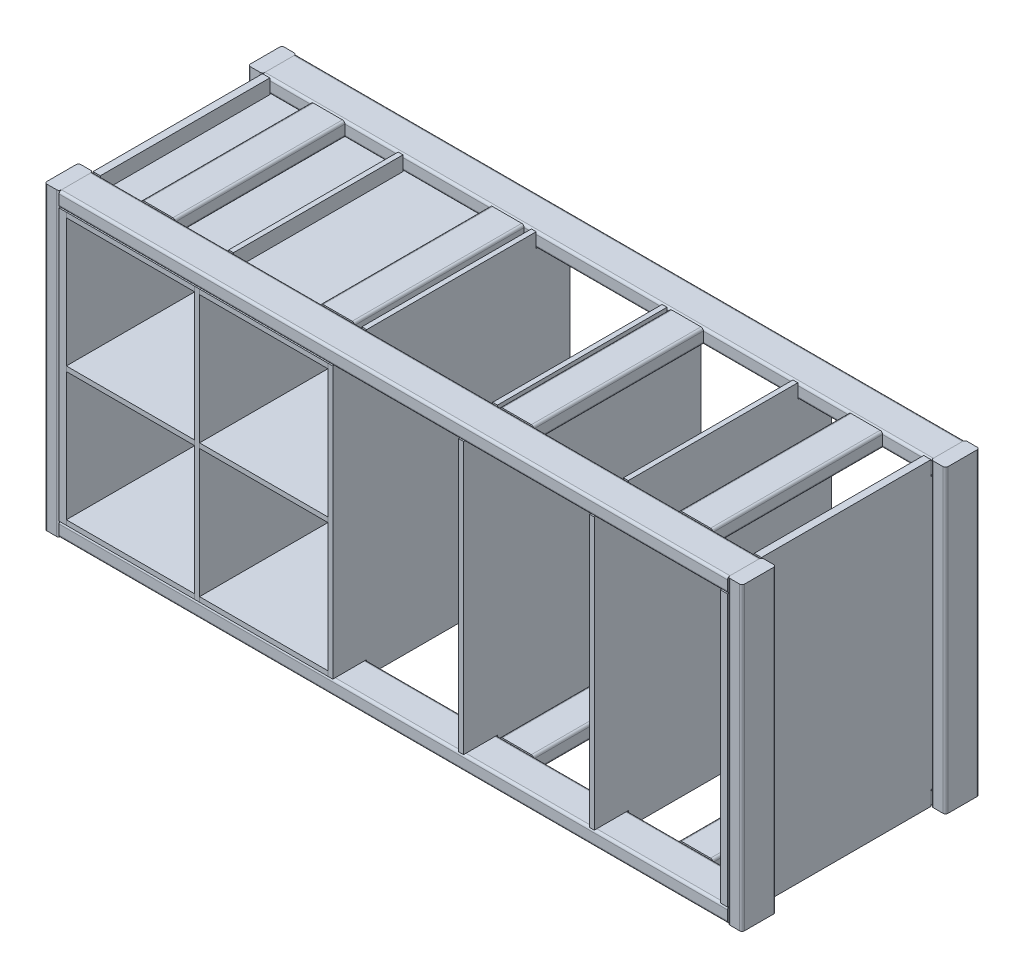
from build123d import *

# Parameters (mm, degrees)
BOSS_EXTRUDE1_DEPTH    = 787.4
BOSS_EXTRUDE1_2_DEPTH  = 787.4
BOSS_EXTRUDE1_3_DEPTH  = 787.4
BOSS_EXTRUDE1_4_DEPTH  = 787.4
BOSS_EXTRUDE2_DEPTH    = 1752.6
BOSS_EXTRUDE2_2_DEPTH  = 1752.6
BOSS_EXTRUDE2_3_DEPTH  = 1752.6
BOSS_EXTRUDE2_4_DEPTH  = 1752.6
BOSS_EXTRUDE5_DEPTH    = 19.05
BOSS_EXTRUDE7_DEPTH    = 12.7
LPATTERN1_COUNT        = 3
LPATTERN1_PITCH        = 342.9
BOSS_EXTRUDE3_DEPTH    = 444.5
BOSS_EXTRUDE3_2_DEPTH  = 444.5
BOSS_EXTRUDE3_3_DEPTH  = 444.5
BOSS_EXTRUDE3_4_DEPTH  = 444.5
BOSS_EXTRUDE6_DEPTH    = 444.5
BOSS_EXTRUDE6_2_DEPTH  = 444.5
BOSS_EXTRUDE6_3_DEPTH  = 444.5
BOSS_EXTRUDE6_4_DEPTH  = 444.5
BOSS_EXTRUDE8_DEPTH    = 6.35
SKETCH14_W             = 685.8
SKETCH14_H             = 711.2
BOSS_EXTRUDE9_DEPTH    = 12.7
SKETCH15_W             = 336.55
SKETCH15_H             = 609.6
BOSS_EXTRUDE10_DEPTH   = 12.7
BOSS_EXTRUDE10_2_DEPTH = 12.7
LPATTERN3_COUNT        = 3
LPATTERN3_PITCH        = 349.25


with BuildPart() as part:
    # Sketch2 → Boss-Extrude1 (new body)
    with BuildSketch(Plane(origin=(0, 0, 0), x_dir=(1, 0, 0), z_dir=(0, 1, 0))):
        with BuildLine():
            Line((12.7, 0), (38.1, 0))
            ThreePointArc((38.1, 0), (42.590128061, -1.859871939), (44.45, -6.35))
            Line((44.45, -6.35), (44.45, -82.55))
            ThreePointArc((44.45, -82.55), (42.590128061, -87.040128061), (38.1, -88.9))
            Line((38.1, -88.9), (12.7, -88.9))
            ThreePointArc((12.7, -88.9), (8.209871939, -87.040128061), (6.35, -82.55))
            Line((6.35, -82.55), (6.35, -6.35))
            ThreePointArc((6.35, -6.35), (8.209871939, -1.859871939), (12.7, 0))
        make_face()
    extrude(amount=BOSS_EXTRUDE1_DEPTH)


with BuildPart() as body_2:
    # Sketch2 → Boss-Extrude1 2 (new body)
    with BuildSketch(Plane(origin=(0, 0, 0), x_dir=(1, 0, 0), z_dir=(0, 1, 0))):
        with BuildLine():
            Line((12.7, -533.4), (38.1, -533.4))
            ThreePointArc((38.1, -533.4), (42.590128061, -535.259871939), (44.45, -539.75))
            Line((44.45, -539.75), (44.45, -615.95))
            ThreePointArc((44.45, -615.95), (42.590128061, -620.440128061), (38.1, -622.3))
            Line((38.1, -622.3), (12.7, -622.3))
            ThreePointArc((12.7, -622.3), (8.209871939, -620.440128061), (6.35, -615.95))
            Line((6.35, -615.95), (6.35, -539.75))
            ThreePointArc((6.35, -539.75), (8.209871939, -535.259871939), (12.7, -533.4))
        make_face()
    extrude(amount=BOSS_EXTRUDE1_2_DEPTH)


with BuildPart() as body_3:
    # Sketch2 → Boss-Extrude1 3 (new body)
    with BuildSketch(Plane(origin=(0, 0, 0), x_dir=(1, 0, 0), z_dir=(0, 1, 0))):
        with BuildLine():
            Line((1803.4, -622.3), (1828.8, -622.3))
            ThreePointArc((1828.8, -622.3), (1833.290128061, -620.440128061), (1835.15, -615.95))
            Line((1835.15, -615.95), (1835.15, -539.75))
            ThreePointArc((1835.15, -539.75), (1833.290128061, -535.259871939), (1828.8, -533.4))
            Line((1828.8, -533.4), (1803.4, -533.4))
            ThreePointArc((1803.4, -533.4), (1798.909871939, -535.259871939), (1797.05, -539.75))
            Line((1797.05, -539.75), (1797.05, -615.95))
            ThreePointArc((1797.05, -615.95), (1798.909871939, -620.440128061), (1803.4, -622.3))
        make_face()
    extrude(amount=BOSS_EXTRUDE1_3_DEPTH)


with BuildPart() as body_4:
    # Sketch2 → Boss-Extrude1 4 (new body)
    with BuildSketch(Plane(origin=(0, 0, 0), x_dir=(1, 0, 0), z_dir=(0, 1, 0))):
        with BuildLine():
            Line((1828.8, -88.9), (1803.4, -88.9))
            ThreePointArc((1803.4, -88.9), (1798.909871939, -87.040128061), (1797.05, -82.55))
            Line((1797.05, -82.55), (1797.05, -6.35))
            ThreePointArc((1797.05, -6.35), (1798.909871939, -1.859871939), (1803.4, 0))
            Line((1803.4, 0), (1828.8, 0))
            ThreePointArc((1828.8, 0), (1833.290128061, -1.859871939), (1835.15, -6.35))
            Line((1835.15, -6.35), (1835.15, -82.55))
            ThreePointArc((1835.15, -82.55), (1833.290128061, -87.040128061), (1828.8, -88.9))
        make_face()
    extrude(amount=BOSS_EXTRUDE1_4_DEPTH)


with BuildPart() as body_5:
    # Sketch3 → Boss-Extrude2 (new body)
    with BuildSketch(Plane(origin=(44.45, 0, 0), x_dir=(0, 0, -1), z_dir=(1, 0, 0))):
        with BuildLine():
            Line((-615.95, 0), (-539.75, 0))
            ThreePointArc((-539.75, 0), (-535.259871939, 1.859871939), (-533.4, 6.35))
            Line((-533.4, 6.35), (-533.4, 31.75))
            ThreePointArc((-533.4, 31.75), (-535.259871939, 36.240128061), (-539.75, 38.1))
            Line((-539.75, 38.1), (-615.95, 38.1))
            ThreePointArc((-615.95, 38.1), (-620.440128061, 36.240128061), (-622.3, 31.75))
            Line((-622.3, 31.75), (-622.3, 6.35))
            ThreePointArc((-622.3, 6.35), (-620.440128061, 1.859871939), (-615.95, 0))
        make_face()
    extrude(amount=BOSS_EXTRUDE2_DEPTH)


with BuildPart() as body_6:
    # Sketch3 → Boss-Extrude2 2 (new body)
    with BuildSketch(Plane(origin=(44.45, 0, 0), x_dir=(0, 0, -1), z_dir=(1, 0, 0))):
        with BuildLine():
            Line((-82.55, 0), (-6.35, 0))
            ThreePointArc((-6.35, 0), (-1.859871939, 1.859871939), (0, 6.35))
            Line((0, 6.35), (0, 31.75))
            ThreePointArc((0, 31.75), (-1.859871939, 36.240128061), (-6.35, 38.1))
            Line((-6.35, 38.1), (-82.55, 38.1))
            ThreePointArc((-82.55, 38.1), (-87.040128061, 36.240128061), (-88.9, 31.75))
            Line((-88.9, 31.75), (-88.9, 6.35))
            ThreePointArc((-88.9, 6.35), (-87.040128061, 1.859871939), (-82.55, 0))
        make_face()
    extrude(amount=BOSS_EXTRUDE2_2_DEPTH)


with BuildPart() as body_7:
    # Sketch3 → Boss-Extrude2 3 (new body)
    with BuildSketch(Plane(origin=(44.45, 0, 0), x_dir=(0, 0, -1), z_dir=(1, 0, 0))):
        with BuildLine():
            Line((-6.35, 787.4), (-82.55, 787.4))
            ThreePointArc((-82.55, 787.4), (-87.040128061, 785.540128061), (-88.9, 781.05))
            Line((-88.9, 781.05), (-88.9, 755.65))
            ThreePointArc((-88.9, 755.65), (-87.040128061, 751.159871939), (-82.55, 749.3))
            Line((-82.55, 749.3), (-6.35, 749.3))
            ThreePointArc((-6.35, 749.3), (-1.859871939, 751.159871939), (0, 755.65))
            Line((0, 755.65), (0, 781.05))
            ThreePointArc((0, 781.05), (-1.859871939, 785.540128061), (-6.35, 787.4))
        make_face()
    extrude(amount=BOSS_EXTRUDE2_3_DEPTH)


with BuildPart() as body_8:
    # Sketch3 → Boss-Extrude2 4 (new body)
    with BuildSketch(Plane(origin=(44.45, 0, 0), x_dir=(0, 0, -1), z_dir=(1, 0, 0))):
        with BuildLine():
            Line((-539.75, 749.3), (-615.95, 749.3))
            ThreePointArc((-615.95, 749.3), (-620.440128061, 751.159871939), (-622.3, 755.65))
            Line((-622.3, 755.65), (-622.3, 781.05))
            ThreePointArc((-622.3, 781.05), (-620.440128061, 785.540128061), (-615.95, 787.4))
            Line((-615.95, 787.4), (-539.75, 787.4))
            ThreePointArc((-539.75, 787.4), (-535.259871939, 785.540128061), (-533.4, 781.05))
            Line((-533.4, 781.05), (-533.4, 755.65))
            ThreePointArc((-533.4, 755.65), (-535.259871939, 751.159871939), (-539.75, 749.3))
        make_face()
    extrude(amount=BOSS_EXTRUDE2_4_DEPTH)


with BuildPart() as body_9:
    # Sketch8 → Boss-Extrude5 (new body)
    with BuildSketch(Plane.ZY.offset(-1797.05)):
        Polygon((622.3, 38.1), (622.3, 749.3), (533.4, 749.3), (533.4, 787.4), (88.9, 787.4), (88.9, 749.3), (0, 749.3), (0, 38.1), (88.9, 38.1), (88.9, 0), (533.4, 0), (533.4, 38.1), align=None)
    extrude(amount=BOSS_EXTRUDE5_DEPTH)


with BuildPart() as body_10:
    # Mirror1: mirrored copy
    add(body_9.part.mirror(Plane(origin=(920.75, 0, 0), x_dir=(0, 0, 1), z_dir=(1, 0, 0))))


with BuildPart() as body_11:
    # Sketch12 → Boss-Extrude7 (new body)
    with BuildSketch(Plane.ZY.offset(-1447.8)):
        Polygon((622.3, 38.1), (622.3, 749.3), (533.4, 749.3), (533.4, 787.4), (88.9, 787.4), (88.9, 749.3), (0, 749.3), (0, 38.1), (88.9, 38.1), (88.9, 0), (533.4, 0), (533.4, 38.1), align=None)
    extrude(amount=BOSS_EXTRUDE7_DEPTH)


with BuildPart() as lpattern1_1:
    # LPattern1: pattern copy
    add(body_11.part.moved(Location(Vector(-1, 0, 0) * (1 * LPATTERN1_PITCH))))


with BuildPart() as lpattern1_2:
    # LPattern1: pattern copy
    add(body_11.part.moved(Location(Vector(-1, 0, 0) * (2 * LPATTERN1_PITCH))))


with BuildPart() as body_14:
    # Sketch4 → Boss-Extrude3 (new body)
    with BuildSketch(Plane.XY.offset(88.9)):
        with BuildLine():
            Line((647.7, 38.1), (723.9, 38.1))
            ThreePointArc((723.9, 38.1), (728.390128061, 36.240128061), (730.25, 31.75))
            Line((730.25, 31.75), (730.25, 6.35))
            ThreePointArc((730.25, 6.35), (728.390128061, 1.859871939), (723.9, 0))
            Line((723.9, 0), (647.7, 0))
            ThreePointArc((647.7, 0), (643.209871939, 1.859871939), (641.35, 6.35))
            Line((641.35, 6.35), (641.35, 31.75))
            ThreePointArc((641.35, 31.75), (643.209871939, 36.240128061), (647.7, 38.1))
        make_face()
    extrude(amount=BOSS_EXTRUDE3_DEPTH)


with BuildPart() as body_15:
    # Sketch4 → Boss-Extrude3 2 (new body)
    with BuildSketch(Plane.XY.offset(88.9)):
        with BuildLine():
            Line((1117.6, 38.1), (1193.8, 38.1))
            ThreePointArc((1193.8, 38.1), (1198.290128061, 36.240128061), (1200.15, 31.75))
            Line((1200.15, 31.75), (1200.15, 6.35))
            ThreePointArc((1200.15, 6.35), (1198.290128061, 1.859871939), (1193.8, 0))
            Line((1193.8, 0), (1117.6, 0))
            ThreePointArc((1117.6, 0), (1113.109871939, 1.859871939), (1111.25, 6.35))
            Line((1111.25, 6.35), (1111.25, 31.75))
            ThreePointArc((1111.25, 31.75), (1113.109871939, 36.240128061), (1117.6, 38.1))
        make_face()
    extrude(amount=BOSS_EXTRUDE3_2_DEPTH)


with BuildPart() as body_16:
    # Sketch4 → Boss-Extrude3 3 (new body)
    with BuildSketch(Plane.XY.offset(88.9)):
        with BuildLine():
            Line((1193.8, 749.3), (1117.6, 749.3))
            ThreePointArc((1117.6, 749.3), (1113.109871939, 751.159871939), (1111.25, 755.65))
            Line((1111.25, 755.65), (1111.25, 781.05))
            ThreePointArc((1111.25, 781.05), (1113.109871939, 785.540128061), (1117.6, 787.4))
            Line((1117.6, 787.4), (1193.8, 787.4))
            ThreePointArc((1193.8, 787.4), (1198.290128061, 785.540128061), (1200.15, 781.05))
            Line((1200.15, 781.05), (1200.15, 755.65))
            ThreePointArc((1200.15, 755.65), (1198.290128061, 751.159871939), (1193.8, 749.3))
        make_face()
    extrude(amount=BOSS_EXTRUDE3_3_DEPTH)


with BuildPart() as body_17:
    # Sketch4 → Boss-Extrude3 4 (new body)
    with BuildSketch(Plane.XY.offset(88.9)):
        with BuildLine():
            Line((723.9, 787.4), (647.7, 787.4))
            ThreePointArc((647.7, 787.4), (643.209871939, 785.540128061), (641.35, 781.05))
            Line((641.35, 781.05), (641.35, 755.65))
            ThreePointArc((641.35, 755.65), (643.209871939, 751.159871939), (647.7, 749.3))
            Line((647.7, 749.3), (723.9, 749.3))
            ThreePointArc((723.9, 749.3), (728.390128061, 751.159871939), (730.25, 755.65))
            Line((730.25, 755.65), (730.25, 781.05))
            ThreePointArc((730.25, 781.05), (728.390128061, 785.540128061), (723.9, 787.4))
        make_face()
    extrude(amount=BOSS_EXTRUDE3_4_DEPTH)


with BuildPart() as body_18:
    # Sketch10 → Boss-Extrude6 (new body)
    with BuildSketch(Plane.XY.offset(88.9)):
        with BuildLine():
            Line((177.8, 38.1), (254, 38.1))
            ThreePointArc((254, 38.1), (258.490128061, 36.240128061), (260.35, 31.75))
            Line((260.35, 31.75), (260.35, 6.35))
            ThreePointArc((260.35, 6.35), (258.490128061, 1.859871939), (254, 0))
            Line((254, 0), (177.8, 0))
            ThreePointArc((177.8, 0), (173.309871939, 1.859871939), (171.45, 6.35))
            Line((171.45, 6.35), (171.45, 31.75))
            ThreePointArc((171.45, 31.75), (173.309871939, 36.240128061), (177.8, 38.1))
        make_face()
    extrude(amount=BOSS_EXTRUDE6_DEPTH)


with BuildPart() as body_19:
    # Sketch10 → Boss-Extrude6 2 (new body)
    with BuildSketch(Plane.XY.offset(88.9)):
        with BuildLine():
            Line((1587.5, 38.1), (1663.7, 38.1))
            ThreePointArc((1663.7, 38.1), (1668.190128061, 36.240128061), (1670.05, 31.75))
            Line((1670.05, 31.75), (1670.05, 6.35))
            ThreePointArc((1670.05, 6.35), (1668.190128061, 1.859871939), (1663.7, 0))
            Line((1663.7, 0), (1587.5, 0))
            ThreePointArc((1587.5, 0), (1583.009871939, 1.859871939), (1581.15, 6.35))
            Line((1581.15, 6.35), (1581.15, 31.75))
            ThreePointArc((1581.15, 31.75), (1583.009871939, 36.240128061), (1587.5, 38.1))
        make_face()
    extrude(amount=BOSS_EXTRUDE6_2_DEPTH)


with BuildPart() as body_20:
    # Sketch10 → Boss-Extrude6 3 (new body)
    with BuildSketch(Plane.XY.offset(88.9)):
        with BuildLine():
            Line((1663.7, 749.3), (1587.5, 749.3))
            ThreePointArc((1587.5, 749.3), (1583.009871939, 751.159871939), (1581.15, 755.65))
            Line((1581.15, 755.65), (1581.15, 781.05))
            ThreePointArc((1581.15, 781.05), (1583.009871939, 785.540128061), (1587.5, 787.4))
            Line((1587.5, 787.4), (1663.7, 787.4))
            ThreePointArc((1663.7, 787.4), (1668.190128061, 785.540128061), (1670.05, 781.05))
            Line((1670.05, 781.05), (1670.05, 755.65))
            ThreePointArc((1670.05, 755.65), (1668.190128061, 751.159871939), (1663.7, 749.3))
        make_face()
    extrude(amount=BOSS_EXTRUDE6_3_DEPTH)


with BuildPart() as body_21:
    # Sketch10 → Boss-Extrude6 4 (new body)
    with BuildSketch(Plane.XY.offset(88.9)):
        with BuildLine():
            Line((254, 787.4), (177.8, 787.4))
            ThreePointArc((177.8, 787.4), (173.309871939, 785.540128061), (171.45, 781.05))
            Line((171.45, 781.05), (171.45, 755.65))
            ThreePointArc((171.45, 755.65), (173.309871939, 751.159871939), (177.8, 749.3))
            Line((177.8, 749.3), (254, 749.3))
            ThreePointArc((254, 749.3), (258.490128061, 751.159871939), (260.35, 755.65))
            Line((260.35, 755.65), (260.35, 781.05))
            ThreePointArc((260.35, 781.05), (258.490128061, 785.540128061), (254, 787.4))
        make_face()
    extrude(amount=BOSS_EXTRUDE6_4_DEPTH)


with BuildPart() as body_22:
    # Sketch13 → Boss-Extrude8 (new, symmetric)
    with BuildSketch(Plane.ZY.offset(-406.4)):
        Polygon((12.7, 749.3), (12.7, 38.1), (88.9, 38.1), (88.9, 0), (533.4, 0), (533.4, 38.1), (622.3, 38.1), (622.3, 749.3), (533.4, 749.3), (533.4, 787.4), (88.9, 787.4), (88.9, 749.3), align=None)
    extrude(amount=BOSS_EXTRUDE8_DEPTH, both=True)


with BuildPart() as body_23:
    # Sketch14 → Boss-Extrude9 (new body)
    with BuildSketch(Plane(origin=(0, 0, 0), x_dir=(-1, 0, 0), z_dir=(0, 0, -1))):
        with Locations((-406.4, 393.7)):
            Rectangle(SKETCH14_W, SKETCH14_H)
    extrude(amount=-BOSS_EXTRUDE9_DEPTH)


with BuildPart() as body_24:
    # Sketch15 → Boss-Extrude10 (new body)
    with BuildSketch(Plane(origin=(0, 38.1, 0), x_dir=(1, 0, 0), z_dir=(0, 1, 0))):
        with Locations((231.775, -317.5)):
            Rectangle(SKETCH15_W, SKETCH15_H)
    extrude(amount=BOSS_EXTRUDE10_DEPTH)


with BuildPart() as body_25:
    # Sketch15 → Boss-Extrude10 2 (new body)
    with BuildSketch(Plane(origin=(0, 38.1, 0), x_dir=(1, 0, 0), z_dir=(0, 1, 0))):
        with Locations((581.025, -317.5)):
            Rectangle(SKETCH15_W, SKETCH15_H)
    extrude(amount=BOSS_EXTRUDE10_2_DEPTH)


with BuildPart() as lpattern3_1:
    # LPattern3: pattern copy
    add(body_25.part.moved(Location(Vector(0, 1, 0) * (1 * LPATTERN3_PITCH))))


with BuildPart() as lpattern3_2:
    # LPattern3: pattern copy
    add(body_25.part.moved(Location(Vector(0, 1, 0) * (2 * LPATTERN3_PITCH))))


with BuildPart() as lpattern3_3:
    # LPattern3: pattern copy
    add(body_24.part.moved(Location(Vector(0, 1, 0) * (1 * LPATTERN3_PITCH))))


with BuildPart() as lpattern3_4:
    # LPattern3: pattern copy
    add(body_24.part.moved(Location(Vector(0, 1, 0) * (2 * LPATTERN3_PITCH))))


solid = Compound([part.part, body_2.part, body_3.part, body_4.part, body_5.part, body_6.part, body_7.part, body_8.part, body_9.part, body_10.part, body_11.part, lpattern1_1.part, lpattern1_2.part, body_14.part, body_15.part, body_16.part, body_17.part, body_18.part, body_19.part, body_20.part, body_21.part, body_22.part, body_23.part, body_24.part, body_25.part, lpattern3_1.part, lpattern3_2.part, lpattern3_3.part, lpattern3_4.part])
